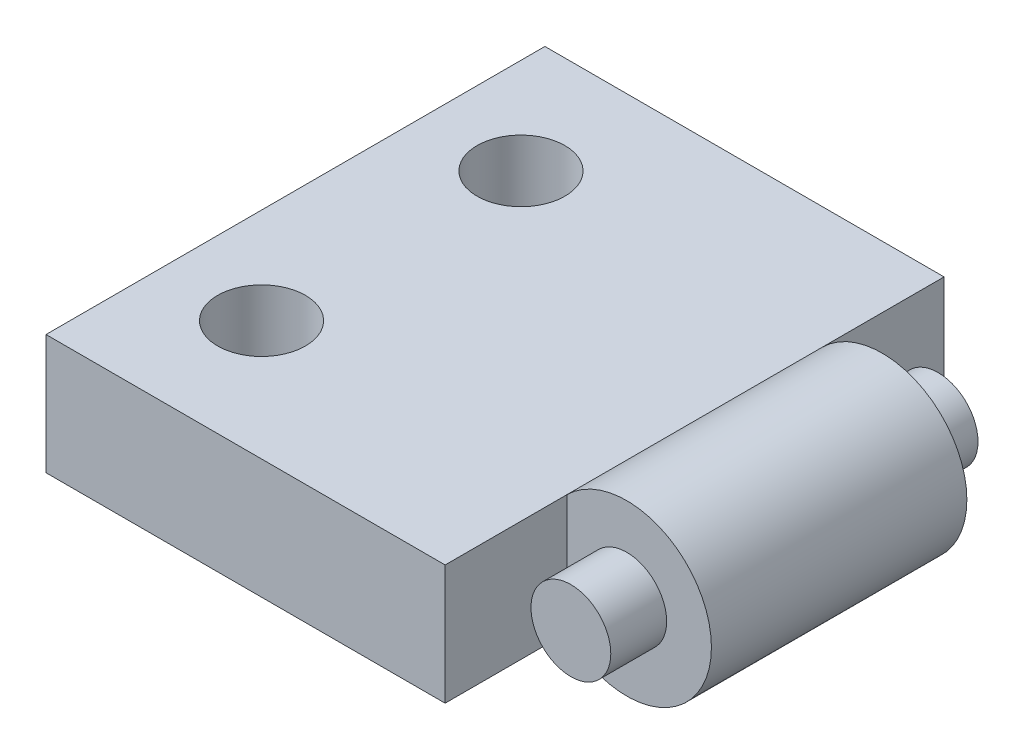
from build123d import *

# Parameters (mm, degrees)
SKETCH3_W                = 12.7
SKETCH3_H                = 15.875
SKETCH3_R                = 1.397
BOSS_EXTRUDE1_DEPTH      = 3.81
BOSS_EXTRUDE2_DEPTH      = 4.064
BOSS_EXTRUDE2_DEPTH_BACK = 4.064
SKETCH5_R                = 2.694076836
SKETCH6_R                = 1.27
BOSS_EXTRUDE3_DEPTH      = 1.778
BOSS_EXTRUDE4_START      = 1.778
SKETCH7_R                = 1.27
BOSS_EXTRUDE4_DEPTH      = 1.778


with BuildPart() as part:
    # Sketch3 → Boss-Extrude1 (new body)
    with BuildSketch(Plane(origin=(0, 0, 0), x_dir=(1, 0, 0), z_dir=(0, 1, 0))):
        with Locations((6.35, 7.9375)):
            Rectangle(SKETCH3_W, SKETCH3_H)
        with Locations(Location((3.048, 3.81, 0), (0, 0, 90))):
            Circle(SKETCH3_R, mode=Mode.SUBTRACT)
        with Locations(Location((3.048, 12.065, 0), (0, 0, 90))):
            Circle(SKETCH3_R, mode=Mode.SUBTRACT)
    extrude(amount=BOSS_EXTRUDE1_DEPTH)

    # Sketch5 → Boss-Extrude2 (add, two sides: drawn at the far end of the back side and taken through both)
    with BuildSketch(Plane.XY.offset(-7.9375).offset(-BOSS_EXTRUDE2_DEPTH_BACK)):
        with Locations((14.605, 1.905)):
            Circle(SKETCH5_R)
    extrude(amount=BOSS_EXTRUDE2_DEPTH + BOSS_EXTRUDE2_DEPTH_BACK)

    # Sketch6 → Boss-Extrude3 (add)
    with BuildSketch(Plane.XY.offset(-3.8735)):
        with Locations((14.605, 1.905)):
            Circle(SKETCH6_R)
    extrude(amount=BOSS_EXTRUDE3_DEPTH)

    # Sketch7 → Boss-Extrude4 (add)
    with BuildSketch(Plane(origin=(0, 0, -12.0015), x_dir=(-1, 0, 0), z_dir=(0, 0, -1)).offset(BOSS_EXTRUDE4_START)):
        with Locations(Location((-14.605, 1.905, 0), (0, 0, 180))):
            Circle(SKETCH7_R)
    extrude(amount=-BOSS_EXTRUDE4_DEPTH)


solid = part.part
